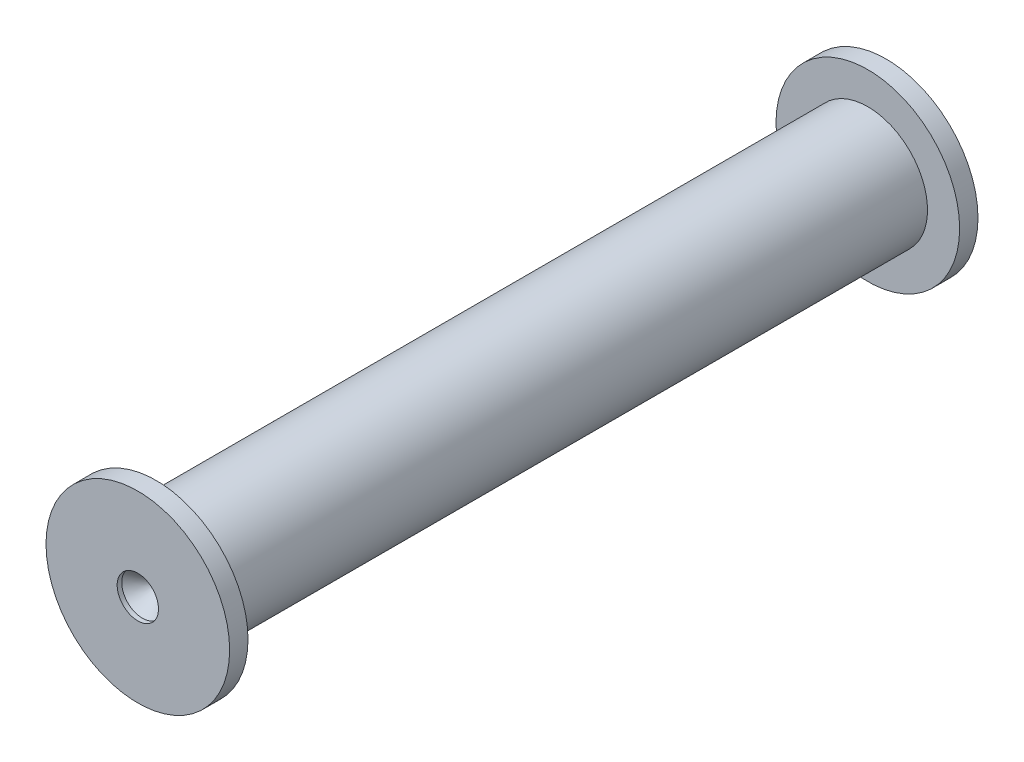
from build123d import *

# Parameters (mm, degrees)
Y_KSEKLIK_EKSTR_ZYON1_DEPTH      = 0.1
Y_KSEKLIK_EKSTR_ZYON1_DEPTH_BACK = 15.4
IZIM1_R                          = 1.3
IZIM2_R                          = 2
Y_KSEKLIK_EKSTR_ZYON2_DEPTH      = 0.4
Y_KSEKLIK_EKSTR_ZYON3_START      = 0.4
IZIM3_R                          = 2
Y_KSEKLIK_EKSTR_ZYON3_DEPTH      = 0.4
IZIM4_R                          = 0.45
KES_EKSTR_ZYON1_DEPTH            = 0.5
PAH1_SIZE                        = 0.4
KES_EKSTR_ZYON2_START            = -0.5
IZIM5_R                          = 0.45
KES_EKSTR_ZYON2_DEPTH            = 0.5
PAH2_SIZE                        = 0.4


with BuildPart() as part:
    # Çizim1 → Yükseklik-Ekstrüzyon1 (new, two sides: drawn at the far end of the back side and taken through both)
    with BuildSketch(Plane.XY.offset(-Y_KSEKLIK_EKSTR_ZYON1_DEPTH_BACK)):
        with Locations((3.3, -31.281939442)):
            Circle(IZIM1_R)
    extrude(amount=Y_KSEKLIK_EKSTR_ZYON1_DEPTH + Y_KSEKLIK_EKSTR_ZYON1_DEPTH_BACK)

    # Çizim2 → Yükseklik-Ekstrüzyon2 (add)
    with BuildSketch(Plane.XY.offset(0.1)):
        with Locations((3.3, -31.281939442)):
            Circle(IZIM2_R)
    extrude(amount=Y_KSEKLIK_EKSTR_ZYON2_DEPTH)

    # Çizim3 → Yükseklik-Ekstrüzyon3 (add)
    with BuildSketch(Plane(origin=(0, 0, -15.4), x_dir=(-1, 0, 0), z_dir=(0, 0, -1)).offset(Y_KSEKLIK_EKSTR_ZYON3_START)):
        with Locations(Location((-3.3, -31.281939442, 0), (0, 0, 180))):
            Circle(IZIM3_R)
    extrude(amount=-Y_KSEKLIK_EKSTR_ZYON3_DEPTH)

    # Çizim4 → Kes-Ekstrüzyon1 (cut)
    with BuildSketch(Plane(origin=(0, 0, -15.8), x_dir=(-1, 0, 0), z_dir=(0, 0, -1))):
        with Locations((-3.3, -31.281939442)):
            Circle(IZIM4_R)
    extrude(amount=-KES_EKSTR_ZYON1_DEPTH, mode=Mode.SUBTRACT)

    # Pah1
    pah1_edges = [part.edges().sort_by_distance(p)[0] for p in [
        (3.75, -31.281939442, -15.3),
    ]]
    chamfer(pah1_edges, length=PAH1_SIZE)

    # Çizim5 → Kes-Ekstrüzyon2 (cut)
    with BuildSketch(Plane.XY.offset(0.5).offset(KES_EKSTR_ZYON2_START)):
        with Locations(Location((3.3, -31.281939442, 0), (0, 0, 180))):
            Circle(IZIM5_R)
    extrude(amount=KES_EKSTR_ZYON2_DEPTH, mode=Mode.SUBTRACT)

    # Pah2
    pah2_edges = [part.edges().sort_by_distance(p)[0] for p in [
        (3.75, -31.281939442, 0),
    ]]
    chamfer(pah2_edges, length=PAH2_SIZE)


solid = part.part
